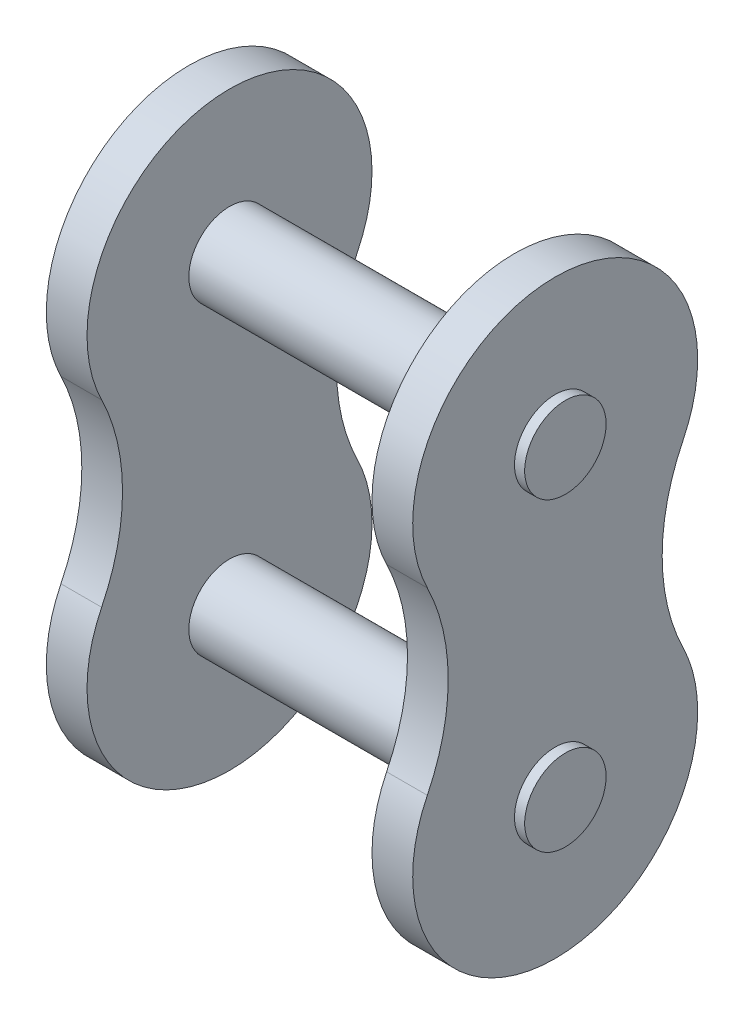
from build123d import *

# Parameters (mm, degrees)
SKETCH2_R                = 1
BOSS_EXTRUDE1_DEPTH      = 1
BOSS_EXTRUDE2_DEPTH      = 3.5
BOSS_EXTRUDE2_DEPTH_BACK = 1.25
SKETCH2_3_R              = 1


with BuildPart() as part:
    # Sketch2 → Boss-Extrude1 (new body)
    with BuildSketch(Plane.YZ):
        with BuildLine():
            ThreePointArc((-2.205882353, 3.140971298), (-7.25, 0), (-2.205882353, -3.140971298))
            ThreePointArc((-2.205882353, -3.140971298), (0, -2.628073151), (2.205882353, -3.140971298))
            ThreePointArc((2.205882353, -3.140971298), (7.25, 0), (2.205882353, 3.140971298))
            ThreePointArc((2.205882353, 3.140971298), (0, 2.628073151), (-2.205882353, 3.140971298))
        make_face()
        with Locations((-3.75, 0)):
            Circle(SKETCH2_R, mode=Mode.SUBTRACT)
        with Locations((3.75, 0)):
            Circle(SKETCH2_R, mode=Mode.SUBTRACT)
    extrude(amount=-BOSS_EXTRUDE1_DEPTH)

    # Sketch2<3> → Boss-Extrude2 (add, two sides: drawn at the far end of the back side and taken through both)
    with BuildSketch(Plane.YZ.offset(-BOSS_EXTRUDE2_DEPTH_BACK)):
        with Locations((-3.75, 0)):
            Circle(SKETCH2_3_R)
        with Locations((3.75, 0)):
            Circle(SKETCH2_3_R)
    extrude(amount=BOSS_EXTRUDE2_DEPTH + BOSS_EXTRUDE2_DEPTH_BACK)

    # Mirror1: part across plane


with BuildPart() as part_1:
    add(part.part)
    add(part.part.mirror(Plane(origin=(3.5, 0, 0), x_dir=(0, 0, 1), z_dir=(1, 0, 0))))


solid = part_1.part
